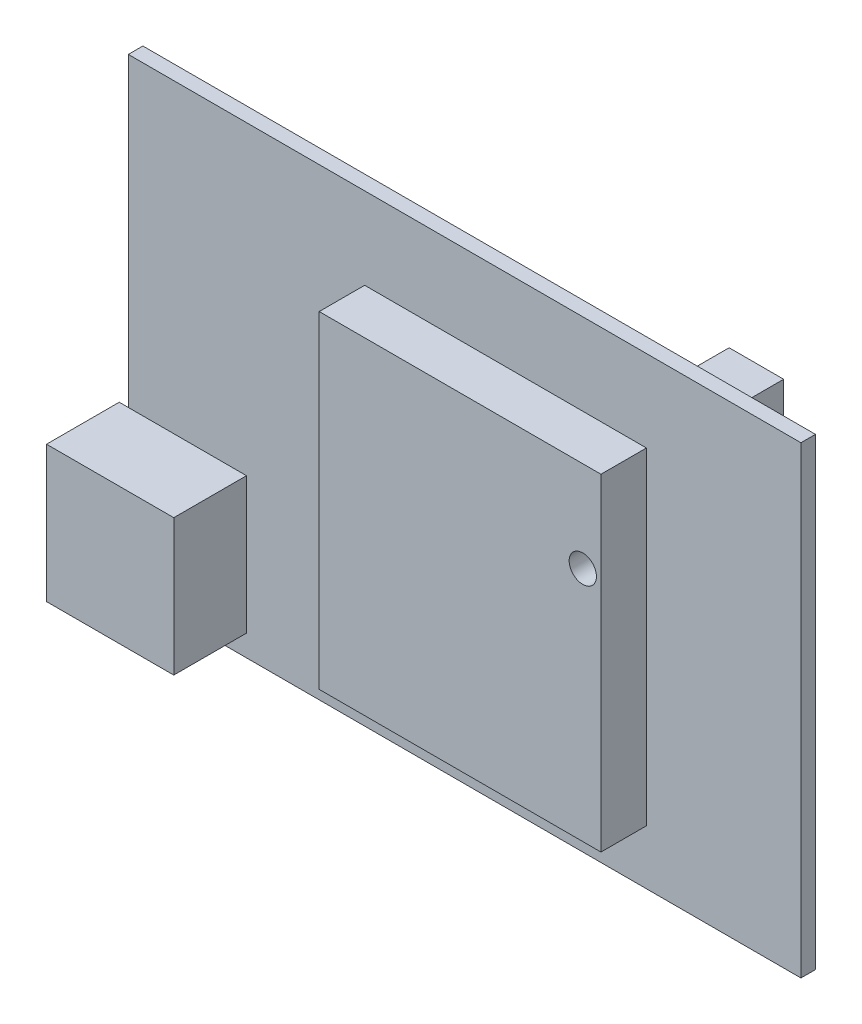
from build123d import *

# Parameters (mm, degrees)
SKETCH1_W               = 74
SKETCH1_H               = 51
BOSS_EXTRUDE1_DEPTH     = 1.6
SKETCH2_W               = 31
SKETCH2_H               = 36
BOSS_EXTRUDE2_DEPTH     = 5
SKETCH3_W               = 14
SKETCH3_H               = 15
BOSS_EXTRUDE3_DEPTH     = 8
SKETCH4_W               = 6
SKETCH4_H               = 49
BOSS_EXTRUDE4_DEPTH     = 4.5
CUT_EXTRUDE1_DEPTH      = 8.5
CUT_EXTRUDE1_DEPTH_BACK = 91.227490268
SKETCH6_R               = 1.5


with BuildPart() as part:
    # Sketch1 → Boss-Extrude1 (new body)
    with BuildSketch(Plane.XY):
        with Locations((37, 25.5)):
            Rectangle(SKETCH1_W, SKETCH1_H)
    extrude(amount=BOSS_EXTRUDE1_DEPTH)

    # Sketch2 → Boss-Extrude2 (add)
    with BuildSketch(Plane.XY.offset(1.6)):
        with Locations((41.5, 24)):
            Rectangle(SKETCH2_W, SKETCH2_H)
    extrude(amount=BOSS_EXTRUDE2_DEPTH)

    # Sketch3 → Boss-Extrude3 (add)
    with BuildSketch(Plane.XY.offset(1.6)):
        with Locations((6, 9.86)):
            Rectangle(SKETCH3_W, SKETCH3_H)
    extrude(amount=BOSS_EXTRUDE3_DEPTH)

    # Sketch4 → Boss-Extrude4 (add)
    with BuildSketch(Plane(origin=(0, 0, 0), x_dir=(-1, 0, 0), z_dir=(0, 0, -1))):
        with Locations((-63, 25.5)):
            Rectangle(SKETCH4_W, SKETCH4_H)
    extrude(amount=BOSS_EXTRUDE4_DEPTH)

    # Sketch6 → Cut-Extrude1 (cut, two sides: drawn at the far end of the back side and taken through both)
    with BuildSketch(Plane.XY.offset(1.6).offset(-CUT_EXTRUDE1_DEPTH_BACK)):
        with Locations(Location((55, 32, 0), (0, 0, 180))):
            Circle(SKETCH6_R)
        with Locations(Location((24, 25.5, 0), (0, 0, 180))):
            Circle(SKETCH6_R)
    extrude(amount=CUT_EXTRUDE1_DEPTH + CUT_EXTRUDE1_DEPTH_BACK, mode=Mode.SUBTRACT)


solid = part.part
